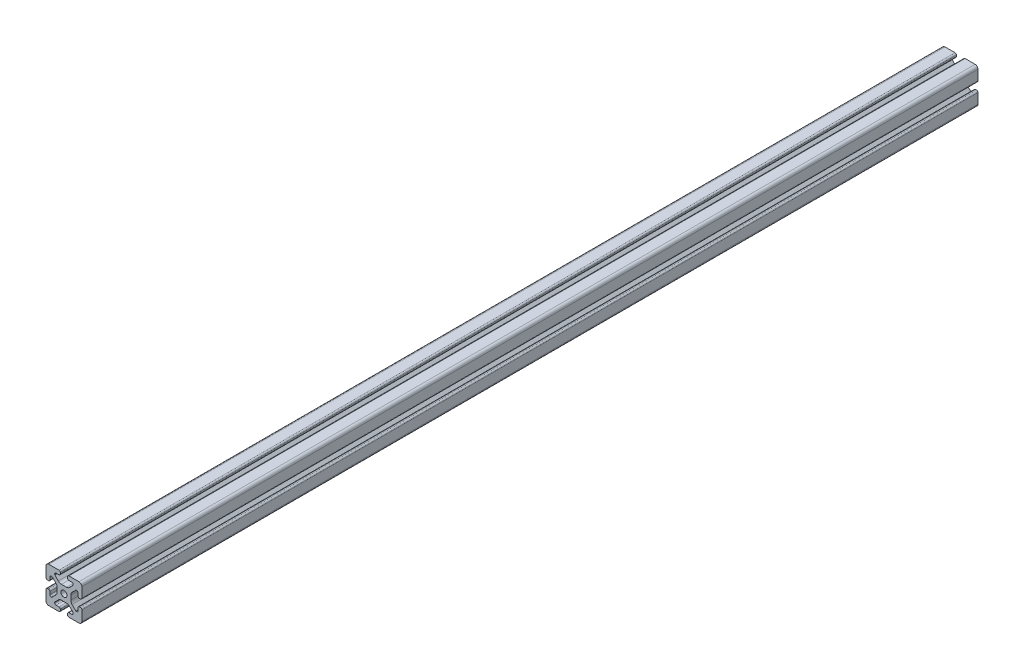
from build123d import *

# Parameters (mm, degrees)
SKETCH1_R           = 3.4
BOSS_EXTRUDE2_DEPTH = 1000


with BuildPart() as part:
    # Sketch1 → Boss-Extrude2 (new body)
    with BuildSketch(Plane.XY):
        with BuildLine():
            Line((-8.715, -15.524615034), (-5.63, -15.524615034))
            ThreePointArc((-5.63, -15.524615034), (-4.519842354, -15.984457388), (-4.06, -17.094615034))
            Line((-4.06, -17.094615034), (-4.06, -18.43))
            ThreePointArc((-4.06, -18.43), (-4.519842354, -19.540157646), (-5.63, -20))
            Line((-5.63, -20), (-16.674615034, -20))
            ThreePointArc((-16.674615034, -20), (-18.951578385, -19.194274381), (-20, -17.018368134))
            Line((-20, -17.018368134), (-20, -5.757918808))
            ThreePointArc((-20, -5.757918808), (-19.564709668, -4.603883664), (-18.43, -4.120449326))
            Line((-18.43, -4.120449326), (-17.248545805, -4.120449326))
            ThreePointArc((-17.248545805, -4.120449326), (-16.114784845, -4.604407881), (-15.67999625, -5.757919334))
            Line((-15.67999625, -5.757919334), (-15.67999625, -8.715399492))
            ThreePointArc((-15.67999625, -8.715399492), (-15.220153896, -9.825557139), (-14.10999625, -10.285399492))
            Line((-14.10999625, -10.285399492), (-13.816903094, -10.285399492))
            ThreePointArc((-13.816903094, -10.285399492), (-13.526063686, -10.227547937), (-13.279501941, -10.062800646))
            Line((-13.279501941, -10.062800646), (-9.076242789, -5.859541495))
            ThreePointArc((-9.076242789, -5.859541495), (-8.046572221, -4.318530588), (-7.685, -2.500784284))
            Line((-7.685, -2.500784284), (-7.685, 2.500784284))
            ThreePointArc((-7.685, 2.500784284), (-8.046572221, 4.318530588), (-9.076242789, 5.859541495))
            Line((-9.076242789, 5.859541495), (-13.040489136, 9.823787841))
            ThreePointArc((-13.040489136, 9.823787841), (-13.354224618, 10.012729352), (-13.71989919, 10.033001362))
            Line((-13.71989919, 10.033001362), (-14.05520779, 10.044710596))
            ThreePointArc((-14.05520779, 10.044710596), (-15.200613642, 9.605030484), (-15.68, 8.475666998))
            Line((-15.68, 8.475666998), (-15.68, 5.572979049))
            ThreePointArc((-15.68, 5.572979049), (-16.139842354, 4.462821403), (-17.25, 4.002979049))
            Line((-17.25, 4.002979049), (-18.43, 4.002979049))
            ThreePointArc((-18.43, 4.002979049), (-19.540157646, 4.462821403), (-20, 5.572979049))
            Line((-20, 5.572979049), (-20, 13.004526564))
            Line((-20, 13.004526564), (-20, 16.83))
            ThreePointArc((-20, 16.83), (-19.071528496, 19.071528496), (-16.83, 20))
            Line((-16.83, 20), (-5.63, 20))
            ThreePointArc((-5.63, 20), (-4.519842354, 19.540157646), (-4.06, 18.43))
            Line((-4.06, 18.43), (-4.06, 17.094615034))
            ThreePointArc((-4.06, 17.094615034), (-4.519842354, 15.984457388), (-5.63, 15.524615034))
            Line((-5.63, 15.524615034), (-8.715, 15.524615034))
            ThreePointArc((-8.715, 15.524615034), (-9.825157646, 15.06477268), (-10.285, 13.954615034))
            Line((-10.285, 13.954615034), (-10.285, 13.492503602))
            ThreePointArc((-10.285, 13.492503602), (-10.227148445, 13.201664194), (-10.062401154, 12.955102448))
            Line((-10.062401154, 12.955102448), (-6.217092793, 9.109794088))
            ThreePointArc((-6.217092793, 9.109794088), (-4.63891877, 8.055291919), (-2.777335583, 7.685))
            Line((-2.777335583, 7.685), (2.777335583, 7.685))
            ThreePointArc((2.777335583, 7.685), (4.63891877, 8.055291919), (6.217092793, 9.109794088))
            Line((6.217092793, 9.109794088), (10.062401154, 12.955102448))
            ThreePointArc((10.062401154, 12.955102448), (10.227148445, 13.201664194), (10.285, 13.492503602))
            Line((10.285, 13.492503602), (10.285, 13.954615034))
            ThreePointArc((10.285, 13.954615034), (9.825157646, 15.06477268), (8.715, 15.524615034))
            Line((8.715, 15.524615034), (5.63, 15.524615034))
            ThreePointArc((5.63, 15.524615034), (4.519842354, 15.984457388), (4.06, 17.094615034))
            Line((4.06, 17.094615034), (4.06, 18.43))
            ThreePointArc((4.06, 18.43), (4.519842354, 19.540157646), (5.63, 20))
            Line((5.63, 20), (12.979635074, 20))
            Line((12.979635074, 20), (16.83, 20))
            ThreePointArc((16.83, 20), (19.071528496, 19.071528496), (20, 16.83))
            Line((20, 16.83), (20, 13.001098436))
            Line((20, 13.001098436), (20, 5.630000526))
            ThreePointArc((20, 5.630000526), (19.540157646, 4.519842879), (18.43, 4.060000526))
            Line((18.43, 4.060000526), (17.24999625, 4.060000526))
            ThreePointArc((17.24999625, 4.060000526), (16.139838603, 4.519842879), (15.67999625, 5.630000526))
            Line((15.67999625, 5.630000526), (15.67999625, 8.715399492))
            ThreePointArc((15.67999625, 8.715399492), (15.220153896, 9.825557139), (14.10999625, 10.285399492))
            Line((14.10999625, 10.285399492), (13.816903094, 10.285399492))
            ThreePointArc((13.816903094, 10.285399492), (13.526063686, 10.227547937), (13.279501941, 10.062800646))
            Line((13.279501941, 10.062800646), (9.076242789, 5.859541495))
            ThreePointArc((9.076242789, 5.859541495), (8.046572221, 4.318530588), (7.685, 2.500784284))
            Line((7.685, 2.500784284), (7.685, -2.500784284))
            ThreePointArc((7.685, -2.500784284), (8.046572221, -4.318530588), (9.076242789, -5.859541495))
            Line((9.076242789, -5.859541495), (13.163657296, -9.946956002))
            ThreePointArc((13.163657296, -9.946956002), (13.35903797, -10.160433474), (13.6200547, -10.285399492))
            Line((13.6200547, -10.285399492), (14.10999625, -10.285399492))
            ThreePointArc((14.10999625, -10.285399492), (15.220153896, -9.825557139), (15.67999625, -8.715399492))
            Line((15.67999625, -8.715399492), (15.67999625, -5.630000526))
            ThreePointArc((15.67999625, -5.630000526), (16.139838603, -4.519842879), (17.24999625, -4.060000526))
            Line((17.24999625, -4.060000526), (18.43, -4.060000526))
            ThreePointArc((18.43, -4.060000526), (19.540157646, -4.519842879), (20, -5.630000526))
            Line((20, -5.630000526), (20, -16.83))
            ThreePointArc((20, -16.83), (19.071528496, -19.071528496), (16.83, -20))
            Line((16.83, -20), (13, -20))
            Line((13, -20), (5.63, -20))
            ThreePointArc((5.63, -20), (4.519842354, -19.540157646), (4.06, -18.43))
            Line((4.06, -18.43), (4.06, -17.094615034))
            ThreePointArc((4.06, -17.094615034), (4.519842354, -15.984457388), (5.63, -15.524615034))
            Line((5.63, -15.524615034), (8.715, -15.524615034))
            ThreePointArc((8.715, -15.524615034), (9.825157646, -15.06477268), (10.285, -13.954615034))
            Line((10.285, -13.954615034), (10.285, -13.492503602))
            ThreePointArc((10.285, -13.492503602), (10.227148445, -13.201664194), (10.062401154, -12.955102448))
            Line((10.062401154, -12.955102448), (6.217092793, -9.109794088))
            ThreePointArc((6.217092793, -9.109794088), (4.63891877, -8.055291919), (2.777335583, -7.685))
            Line((2.777335583, -7.685), (-2.777335583, -7.685))
            ThreePointArc((-2.777335583, -7.685), (-4.63891877, -8.055291919), (-6.217092793, -9.109794088))
            Line((-6.217092793, -9.109794088), (-10.062401154, -12.955102448))
            ThreePointArc((-10.062401154, -12.955102448), (-10.227148445, -13.201664194), (-10.285, -13.492503602))
            Line((-10.285, -13.492503602), (-10.285, -13.954615034))
            ThreePointArc((-10.285, -13.954615034), (-9.825157646, -15.06477268), (-8.715, -15.524615034))
        make_face()
        Circle(SKETCH1_R, mode=Mode.SUBTRACT)
    extrude(amount=BOSS_EXTRUDE2_DEPTH)


solid = part.part
